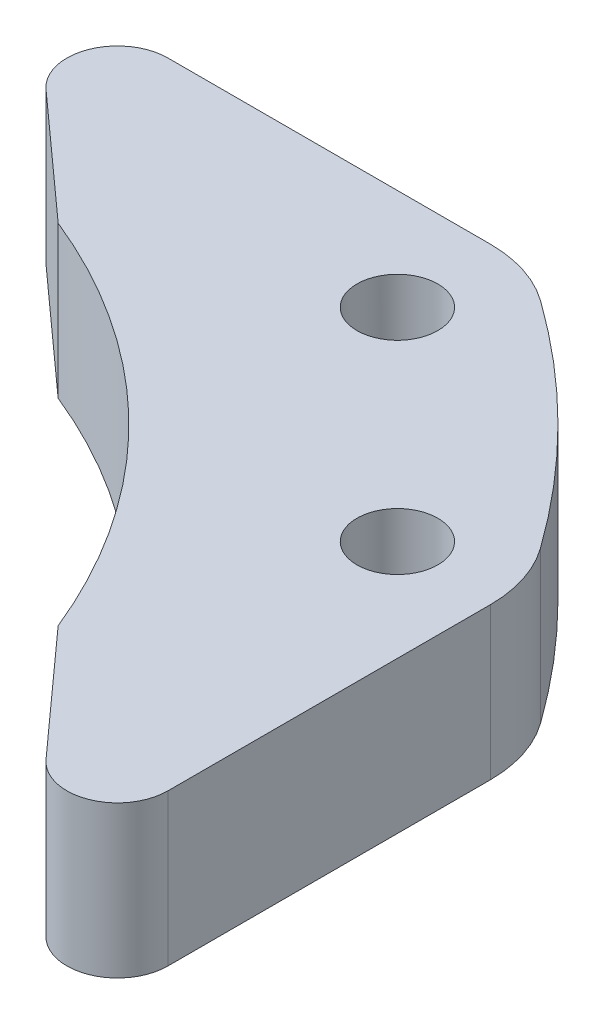
from build123d import *

# Parameters (mm, degrees)
EXTRUDE_1_DEPTH     = 6
SKETCH_2_R          = 1.6
CUT_EXTRUDE_1_DEPTH = 10
SKETCH_3_OUTSIDE_W  = 89.27
SKETCH_3_OUTSIDE_H  = 89.27
CUT_EXTRUDE_2_DEPTH = 10
FILLET_1_R          = 5
FILLET_2_R          = 2


with BuildPart() as part:
    # 草图1 → 凸台-拉伸1 (new body)
    with BuildSketch(Plane(origin=(0, 0, 0), x_dir=(1, 0, 0), z_dir=(0, 1, 0))):
        with BuildLine():
            Line((-20.199009877, 31), (20.199009877, 31))
            ThreePointArc((20.199009877, 31), (26.162950904, 26.162950904), (31, 20.199009877))
            Line((31, 20.199009877), (31, -20.199009877))
            ThreePointArc((31, -20.199009877), (-26.162950904, -26.162950904), (-20.199009877, 31))
        make_face()
    extrude(amount=EXTRUDE_1_DEPTH)

    # 草图2 → 切除-拉伸1 (cut)
    with BuildSketch(Plane(origin=(0, 6, 0), x_dir=(1, 0, 0), z_dir=(0, 1, 0))):
        with Locations(Location((26.998940675, 18.975173317, 0), (0, 0, 270))):
            Circle(SKETCH_2_R)
        with Locations(Location((18.975173317, 26.998940675, 0), (0, 0, 270))):
            Circle(SKETCH_2_R)
    extrude(amount=-CUT_EXTRUDE_1_DEPTH, mode=Mode.SUBTRACT)

    # 草图3 outside → 切除-拉伸2 (cut)
    with BuildSketch(Plane(origin=(0, 6, 0), x_dir=(1, 0, 0), z_dir=(0, 1, 0))):
        with Locations((-3, -3)):
            Rectangle(SKETCH_3_OUTSIDE_W, SKETCH_3_OUTSIDE_H)
        with BuildLine():
            Line((0.691210962, 31), (9.386018717, 23.171159933))
            ThreePointArc((9.386018717, 23.171159933), (17.67766953, 17.67766953), (23.171159933, 9.386018717))
            Line((23.171159933, 9.386018717), (31, 0.691210962))
            Line((31, 0.691210962), (31, 20.199009877))
            ThreePointArc((31, 20.199009877), (26.162950904, 26.162950904), (20.199009877, 31))
            Line((20.199009877, 31), (0.691210962, 31))
        make_face(mode=Mode.SUBTRACT)
    extrude(amount=-CUT_EXTRUDE_2_DEPTH, mode=Mode.SUBTRACT)

    # 圆角1
    fillet_1_edges = [part.edges().sort_by_distance(p)[0] for p in [
        (20.199009877, 3, -31),
        (31, 3, -20.199009877),
    ]]
    fillet(fillet_1_edges, radius=FILLET_1_R)

    # 圆角2
    fillet_2_edges = [part.edges().sort_by_distance(p)[0] for p in [
        (31, 3, -0.691210962),
        (0.691210962, 3, -31),
    ]]
    fillet(fillet_2_edges, radius=FILLET_2_R)


solid = part.part
